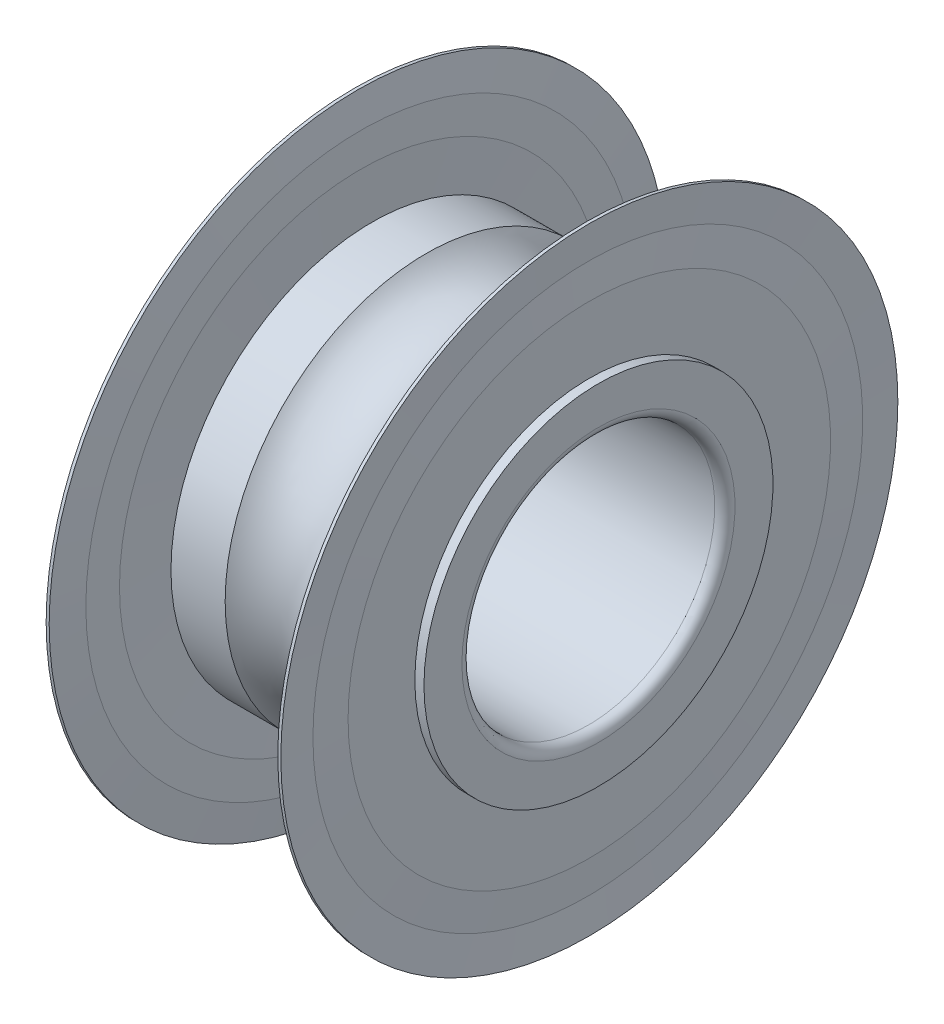
from build123d import *


with BuildPart() as part:
    # Sketch1 → Revolve1 (revolve)
    with BuildSketch(Plane.XY, mode=Mode.PRIVATE) as revolve1_sk:
        with BuildLine():
            Line((0.2, 2.499825), (4.8, 2.499825))
            ThreePointArc((4.8, 2.499825), (4.941421356, 2.558403644), (5, 2.699825))
            Line((5, 2.699825), (5, 3.976))
            Line((5, 3.976), (3.404551961, 3.976))
            ThreePointArc((3.404551961, 3.976), (2.5, 3.5595), (1.595448039, 3.976))
            Line((1.595448039, 3.976), (0, 3.976))
            Line((0, 3.976), (0, 2.699825))
            ThreePointArc((0, 2.699825), (0.058578644, 2.558403644), (0.2, 2.499825))
        make_face()
    revolve(revolve1_sk.sketch.rotate(Axis((50, 0, 0), (-1, 0, 0)), 270), axis=Axis((50, 0, 0), (-1, 0, 0)))

    # Sketch2 → Cut-Revolve1 (revolve, cut)
    with BuildSketch(Plane.XY, mode=Mode.PRIVATE) as cut_revolve1_sk:
        with BuildLine():
            Line((0, 4.6375), (0, 3.45))
            Line((0, 3.45), (0.262, 3.45))
            ThreePointArc((0.262, 3.45), (0.447261977, 3.526738023), (0.524, 3.712))
            Line((0.524, 3.712), (0.524, 4.1135))
            Line((0.524, 4.1135), (4.476, 4.1135))
            Line((4.476, 4.1135), (4.476, 3.712))
            ThreePointArc((4.476, 3.712), (4.552738023, 3.526738023), (4.738, 3.45))
            Line((4.738, 3.45), (5, 3.45))
            Line((5, 3.45), (5, 4.6375))
            Line((5, 4.6375), (0, 4.6375))
        make_face()
    revolve(cut_revolve1_sk.sketch.rotate(Axis((50, 0, 0), (-1, 0, 0)), 270), axis=Axis((50, 0, 0), (-1, 0, 0)), mode=Mode.SUBTRACT)

    # Sketch3 → Revolve2 (revolve)
    with BuildSketch(Plane.XY, mode=Mode.PRIVATE) as revolve2_sk:
        Polygon((0.18, 6.1), (0.21, 5.435), (0.18, 4.77), (0.18, 3.44), (0.24, 3.44), (0.3, 4.77), (0.3, 5.435), (0.24, 6.1), align=None)
    revolve(revolve2_sk.sketch.rotate(Axis((50, 0, 0), (-1, 0, 0)), 270), axis=Axis((50, 0, 0), (-1, 0, 0)))

    # Sketch4 → Revolve3 (revolve)
    with BuildSketch(Plane.XY, mode=Mode.PRIVATE) as revolve3_sk:
        Polygon((4.7, 5.435), (4.7, 4.77), (4.76, 3.44), (4.82, 3.44), (4.82, 4.77), (4.79, 5.435), (4.82, 6.1), (4.76, 6.1), align=None)
    revolve(revolve3_sk.sketch.rotate(Axis((50, 0, 0), (-1, 0, 0)), 270), axis=Axis((50, 0, 0), (-1, 0, 0)))


solid = part.part
